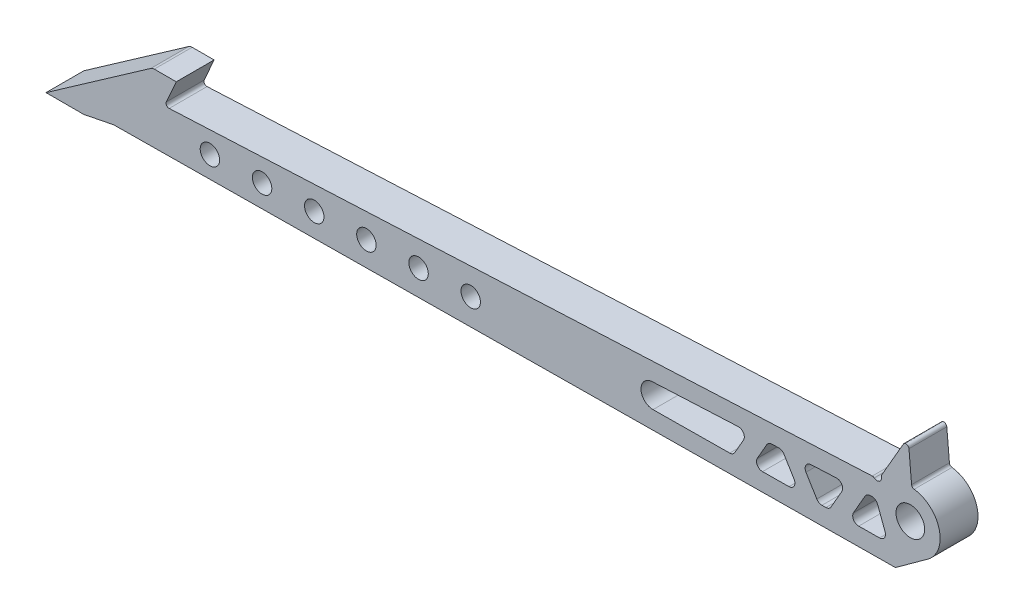
from build123d import *

# Parameters (mm, degrees)
SKETCH1_R           = 3.2639
SKETCH1_R_2         = 4.8025
BOSS_EXTRUDE1_DEPTH = 12.7
SKETCH2_R           = 1.5
CUT_EXTRUDE1_DEPTH  = 290.340643879
EXTRUDE_THIN1_DEPTH = 12.7
FILLET1_R           = 2
FILLET2_R           = 1
FILLET3_R           = 1
FILLET4_R           = 2
FILLET5_R           = 1


with BuildPart() as part:
    # Sketch1 → Boss-Extrude1 (new body)
    with BuildSketch(Plane.XY):
        with BuildLine():
            Line((-266.801436578, 66.762186411), (-254.101436578, 66.762186411))
            Line((-254.101436578, 66.762186411), (-244.101436578, 68.762186411))
            Line((-244.101436578, 68.762186411), (18.198563422, 71.262186411))
            Line((18.198563422, 71.262186411), (29.067448443, 79.140508783))
            ThreePointArc((29.067448443, 79.140508783), (32.782860984, 90.090472281), (23.683493494, 97.225421632))
            Line((23.683493494, 97.225421632), (22.457622919, 111.237186411))
            Line((22.457622919, 111.237186411), (12.547030644, 94.071537057))
            Line((12.547030644, 94.071537057), (-227.097736409, 82.762186411))
            Line((-227.097736409, 82.762186411), (-223.097736409, 91.762186411))
            Line((-223.097736409, 91.762186411), (-231.097736409, 91.762186411))
            Line((-231.097736409, 91.762186411), (-266.801436578, 66.762186411))
        make_face()
        with Locations((-211.801436578, 76.277045814)):
            Circle(SKETCH1_R, mode=Mode.SUBTRACT)
        with BuildLine():
            ThreePointArc((-191.038845177, 76.865160679), (-194.209021403, 73.510154104), (-197.564027978, 76.68033033))
            ThreePointArc((-197.564027978, 76.68033033), (-194.393851752, 80.035336905), (-191.038845177, 76.865160679))
        make_face(mode=Mode.SUBTRACT)
        with BuildLine():
            ThreePointArc((-173.538845177, 77.360860369), (-176.709021403, 74.005853795), (-180.064027978, 77.176030021))
            ThreePointArc((-180.064027978, 77.176030021), (-176.893851752, 80.531036596), (-173.538845177, 77.360860369))
        make_face(mode=Mode.SUBTRACT)
        with BuildLine():
            ThreePointArc((-156.038845177, 77.85656006), (-159.209021403, 74.501553486), (-162.564027978, 77.671729712))
            ThreePointArc((-162.564027978, 77.671729712), (-159.393851752, 81.026736286), (-156.038845177, 77.85656006))
        make_face(mode=Mode.SUBTRACT)
        with BuildLine():
            ThreePointArc((-138.538845177, 78.352259751), (-141.709021403, 74.997253177), (-145.064027978, 78.167429403))
            ThreePointArc((-145.064027978, 78.167429403), (-141.893851752, 81.522435977), (-138.538845177, 78.352259751))
        make_face(mode=Mode.SUBTRACT)
        with Locations((-124.301436578, 78.755544268)):
            Circle(SKETCH1_R, mode=Mode.SUBTRACT)
        with BuildLine():
            ThreePointArc((-63.133141977, 76.487280646), (-67.169657877, 80.373738274), (-63.359823259, 84.482652205))
            Line((-63.359823259, 84.482652205), (11.69023184, 88.024425303))
            Line((11.69023184, 88.024425303), (15.732641912, 77.238956055))
            Line((15.732641912, 77.238956055), (-63.133141977, 76.487280646))
        make_face(mode=Mode.SUBTRACT)
        with Locations((23.198563422, 87.237186411)):
            Circle(SKETCH1_R_2, mode=Mode.SUBTRACT)
    extrude(amount=BOSS_EXTRUDE1_DEPTH)

    # Sketch2 → Cut-Extrude1 (cut, through all)
    with BuildSketch(Plane.XY.offset(12.7)):
        with Locations((12.027614403, 94.926058425)):
            Circle(SKETCH2_R)
    extrude(amount=-CUT_EXTRUDE1_DEPTH, mode=Mode.SUBTRACT)

    # Sketch3 → Extrude-Thin1 (add)
    with BuildSketch(Plane.XY.offset(12.7)):
        Polygon((4.395331666, 91.692317271), (2.904697232, 89.088856309), (-3.18794246, 78.447783473), (-4.678576894, 75.84432251), (0.09443487, 73.111492713), (1.585069304, 75.714953675), (7.677708996, 86.356026512), (9.16834343, 88.959487474), align=None)
        Polygon((-6.373627789, 74.99582825), (-8.450873433, 78.41416857), (-14.34461761, 88.112984603), (-16.421863253, 91.531324922), (-21.122081192, 88.675112163), (-19.044835548, 85.256771844), (-13.151091371, 75.55795581), (-11.073845728, 72.139615491), align=None)
        Polygon((-28.590598026, 90.135640487), (-30.081232461, 87.532179525), (-35.458687829, 78.140208698), (-36.949322263, 75.536747736), (-32.176310499, 72.803917938), (-30.685676065, 75.407378901), (-25.308220697, 84.799349728), (-23.817586262, 87.40281069), align=None)
    extrude(amount=-EXTRUDE_THIN1_DEPTH)

    # Fillet1
    fillet1_edges = [part.edges().sort_by_distance(p)[0] for p in [
        (8.548063104, 87.87613962, 6.35),
        (-14.000387945, 76.955568427, 6.35),
        (-19.822952565, 86.537250529, 6.35),
        (-7.601576859, 77.016555952, 6.35),
        (-13.566500594, 86.832505919, 6.35),
        (-36.258428338, 76.743425458, 6.35),
        (-30.951586569, 86.012066417, 6.35),
        (-29.885935555, 76.804162141, 6.35),
        (-24.437866589, 86.319462836, 6.35),
        (15.732641912, 77.238956055, 6.35),
        (11.69023184, 88.024425303, 6.35),
        (-3.987682969, 77.051000232, 6.35),
        (2.034343123, 87.568743201, 6.35),
        (2.384809814, 77.111736915, 6.35),
    ]]
    fillet(fillet1_edges, radius=FILLET1_R)

    # Fillet2
    fillet2_edges = [part.edges().sort_by_distance(p)[0] for p in [
        (13.39561857, 95.54133446, 6.35),
        (10.854209367, 93.991649189, 6.35),
    ]]
    fillet(fillet2_edges, radius=FILLET2_R)

    # Fillet3
    fillet3_edges = [part.edges().sort_by_distance(p)[0] for p in [
        (-227.097736409, 82.762186411, 6.35),
    ]]
    fillet(fillet3_edges, radius=FILLET3_R)

    # Fillet4
    fillet4_edges = [part.edges().sort_by_distance(p)[0] for p in [
        (-231.097736409, 91.762186411, 6.35),
    ]]
    fillet(fillet4_edges, radius=FILLET4_R)

    # Fillet5
    fillet5_edges = [part.edges().sort_by_distance(p)[0] for p in [
        (22.457622919, 111.237186411, 6.35),
        (23.683493494, 97.225421632, 6.35),
    ]]
    fillet(fillet5_edges, radius=FILLET5_R)


solid = part.part
